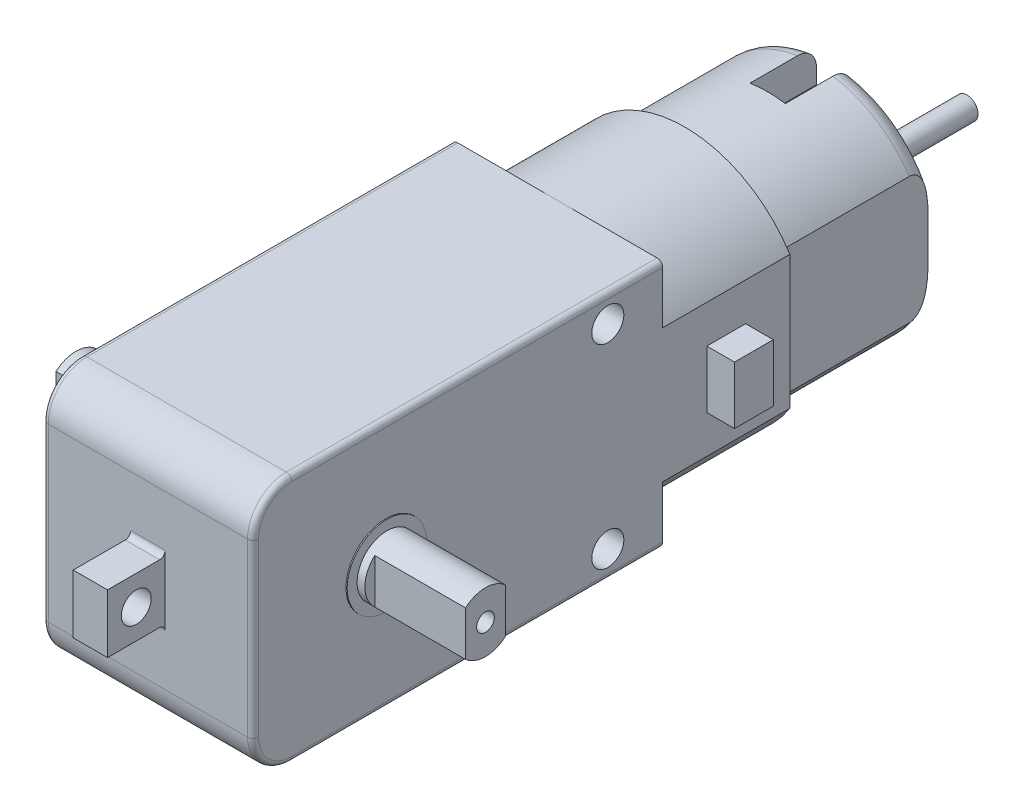
from build123d import *

# Parameters (mm, degrees)
SKETCH1_W                 = 37
SKETCH1_H                 = 22.5
BOSS_EXTRUDE1_DEPTH       = 19
SKETCH2_W                 = 3.1
SKETCH2_H                 = 5.3
BOSS_EXTRUDE2_DEPTH       = 5.2
SKETCH3_R                 = 1.35
CUT_EXTRUDE1_DEPTH        = 46.050027747
FILLET1_R                 = 3.5
SKETCH4_R                 = 3.6
BOSS_EXTRUDE3_DEPTH       = 0.1
BOSS_EXTRUDE4_START       = 0.1
SKETCH5_R                 = 3.6
BOSS_EXTRUDE4_DEPTH       = 0.1
SKETCH6_R                 = 2.7
BOSS_EXTRUDE5_DEPTH       = 8.9
BOSS_EXTRUDE6_START       = 8.9
SKETCH7_R                 = 2.7
BOSS_EXTRUDE6_DEPTH       = 8.9
FILLET2_R                 = 0.5
CUT_EXTRUDE2_START        = -8.2
CUT_EXTRUDE2_DEPTH        = 8.2
CUT_EXTRUDE3_DEPTH        = 8.2
M2X0_4_TAPPED_HOLE1_D     = 1.6
M2X0_4_TAPPED_HOLE1_DEPTH = 5.2
M2X0_4_TAPPED_HOLE1_TIP   = 0.480688495
M2X0_4_TAPPED_HOLE2_D     = 1.6
M2X0_4_TAPPED_HOLE2_DEPTH = 5.2
M2X0_4_TAPPED_HOLE2_TIP   = 0.480688495
SKETCH16_R                = 1.95
BOSS_EXTRUDE7_DEPTH       = 2
BOSS_EXTRUDE8_DEPTH       = 11.5
SKETCH18_W                = 3.5
SKETCH18_H                = 5.2
BOSS_EXTRUDE9_DEPTH       = 2.5
SKETCH19_W                = 3.5
SKETCH19_H                = 5.2
BOSS_EXTRUDE10_DEPTH      = 2.5
BOSS_EXTRUDE11_DEPTH      = 13.5
FILLET3_R                 = 1.7
BOSS_EXTRUDE12_DEPTH      = 2
SKETCH23_W                = 3.2
SKETCH23_H                = 6.5
SKETCH23_H_2              = 8.5
CUT_EXTRUDE4_DEPTH        = 6
SKETCH25_R                = 1.45
CUT_EXTRUDE5_DEPTH        = 52.878728782
FILLET4_R                 = 0.5
SKETCH26_R                = 1
BOSS_EXTRUDE13_DEPTH      = 10


with BuildPart() as part:
    # Sketch1 → Boss-Extrude1 (new body)
    with BuildSketch(Plane(origin=(0, 0, 0), x_dir=(0, 0, -1), z_dir=(1, 0, 0))):
        with Locations((-18.5, 0)):
            Rectangle(SKETCH1_W, SKETCH1_H)
    extrude(amount=BOSS_EXTRUDE1_DEPTH)

    # Sketch2 → Boss-Extrude2 (add)
    with BuildSketch(Plane.XY.offset(37)):
        with Locations((9.5, 0)):
            Rectangle(SKETCH2_W, SKETCH2_H)
    extrude(amount=BOSS_EXTRUDE2_DEPTH)

    # Sketch3 → Cut-Extrude1 (cut, through all)
    with BuildSketch(Plane(origin=(11.05, 0, 0), x_dir=(0, 0, -1), z_dir=(1, 0, 0))):
        with Locations((-39.6, 0)):
            Circle(SKETCH3_R)
    extrude(amount=-CUT_EXTRUDE1_DEPTH, mode=Mode.SUBTRACT)

    # Fillet1
    fillet1_edges = [part.edges().sort_by_distance(p)[0] for p in [
        (9.5, -11.25, 37),
        (9.5, 11.25, 37),
    ]]
    fillet(fillet1_edges, radius=FILLET1_R)

    # Sketch4 → Boss-Extrude3 (add)
    with BuildSketch(Plane(origin=(19, 0, 0), x_dir=(0, 0, -1), z_dir=(1, 0, 0))):
        with Locations(Location((-25, 0, 0), (0, 0, 180))):
            Circle(SKETCH4_R)
    extrude(amount=BOSS_EXTRUDE3_DEPTH)

    # Sketch5 → Boss-Extrude4 (add)
    with BuildSketch(Plane.ZY.offset(BOSS_EXTRUDE4_START)):
        with Locations((25, 0)):
            Circle(SKETCH5_R)
    extrude(amount=-BOSS_EXTRUDE4_DEPTH)

    # Sketch6 → Boss-Extrude5 (add)
    with BuildSketch(Plane(origin=(19.1, 0, 0), x_dir=(0, 0, -1), z_dir=(1, 0, 0))):
        with Locations((-25, 0)):
            Circle(SKETCH6_R)
    extrude(amount=BOSS_EXTRUDE5_DEPTH)

    # Sketch7 → Boss-Extrude6 (add)
    with BuildSketch(Plane.ZY.offset(0.1).offset(BOSS_EXTRUDE6_START)):
        with Locations(Location((25, 0, 0), (0, 0, 180))):
            Circle(SKETCH7_R)
    extrude(amount=-BOSS_EXTRUDE6_DEPTH)

    # Fillet2
    fillet2_edges = [part.edges().sort_by_distance(p)[0] for p in [
        (9.5, 2.65, 37),
        (9.5, -2.65, 37),
    ]]
    fillet(fillet2_edges, radius=FILLET2_R)

    # Sketch8 → Cut-Extrude2 (cut)
    with BuildSketch(Plane(origin=(28, 0, 0), x_dir=(0, 0, -1), z_dir=(1, 0, 0)).offset(CUT_EXTRUDE2_START)):
        with BuildLine():
            Line((-26.8, -2.01246118), (-26.8, 2.01246118))
            ThreePointArc((-26.8, 2.01246118), (-27.7, 0), (-26.8, -2.01246118))
        make_face()
        with BuildLine():
            ThreePointArc((-22.3, 0), (-22.535248491, 1.102270384), (-23.2, 2.01246118))
            Line((-23.2, 2.01246118), (-23.2, -2.01246118))
            ThreePointArc((-23.2, -2.01246118), (-22.535248491, -1.102270384), (-22.3, 0))
        make_face()
    extrude(amount=CUT_EXTRUDE2_DEPTH, mode=Mode.SUBTRACT)

    # Sketch9 → Cut-Extrude3 (cut)
    with BuildSketch(Plane.ZY.offset(9)):
        with BuildLine():
            Line((23.2, -2.01246118), (23.2, 2.01246118))
            ThreePointArc((23.2, 2.01246118), (22.3, 0), (23.2, -2.01246118))
        make_face()
        with BuildLine():
            ThreePointArc((27.7, 0), (27.464751509, 1.102270384), (26.8, 2.01246118))
            Line((26.8, 2.01246118), (26.8, -2.01246118))
            ThreePointArc((26.8, -2.01246118), (27.464751509, -1.102270384), (27.7, 0))
        make_face()
    extrude(amount=-CUT_EXTRUDE3_DEPTH, mode=Mode.SUBTRACT)

    # M2x0.4 Tapped Hole1
    with Locations(Plane(origin=(28, 0, 0), x_dir=(0, 0, -1), z_dir=(1, 0, 0))):
        with Locations((-25, 0)):
            Hole(M2X0_4_TAPPED_HOLE1_D / 2, depth=M2X0_4_TAPPED_HOLE1_DEPTH)
            with Locations((0, 0, -(M2X0_4_TAPPED_HOLE1_DEPTH + M2X0_4_TAPPED_HOLE1_TIP / 2))):  # 118° drill point
                Cone(0, M2X0_4_TAPPED_HOLE1_D / 2, M2X0_4_TAPPED_HOLE1_TIP, mode=Mode.SUBTRACT)

    # M2x0.4 Tapped Hole2
    with Locations(Plane.ZY.offset(9)):
        with Locations((25, 0)):
            Hole(M2X0_4_TAPPED_HOLE2_D / 2, depth=M2X0_4_TAPPED_HOLE2_DEPTH)
            with Locations((0, 0, -(M2X0_4_TAPPED_HOLE2_DEPTH + M2X0_4_TAPPED_HOLE2_TIP / 2))):  # 118° drill point
                Cone(0, M2X0_4_TAPPED_HOLE2_D / 2, M2X0_4_TAPPED_HOLE2_TIP, mode=Mode.SUBTRACT)

    # Sketch16 → Boss-Extrude7 (add)
    with BuildSketch(Plane.ZY):
        with Locations((13.75, 0)):
            Circle(SKETCH16_R)
    extrude(amount=BOSS_EXTRUDE7_DEPTH)

    # Sketch17 → Boss-Extrude8 (add)
    with BuildSketch(Plane(origin=(0, 0, 0), x_dir=(-1, 0, 0), z_dir=(0, 0, -1))):
        with BuildLine():
            Line((-19, 6.025985397), (-19, -6.025985397))
            ThreePointArc((-19, -6.025985397), (-10.560588754, -11.199895156), (-1.3, -7.7021101))
            Line((-1.3, -7.7021101), (-1.3, 7.7021101))
            ThreePointArc((-1.3, 7.7021101), (-10.560588754, 11.199895156), (-19, 6.025985397))
        make_face()
    extrude(amount=BOSS_EXTRUDE8_DEPTH)

    # Sketch18 → Boss-Extrude9 (add)
    with BuildSketch(Plane(origin=(19, 0, 0), x_dir=(0, 0, -1), z_dir=(1, 0, 0))):
        with Locations((5.75, 0)):
            Rectangle(SKETCH18_W, SKETCH18_H)
    extrude(amount=BOSS_EXTRUDE9_DEPTH)

    # Sketch19 → Boss-Extrude10 (add)
    with BuildSketch(Plane.ZY.offset(-1.3)):
        with Locations((-5.75, 0)):
            Rectangle(SKETCH19_W, SKETCH19_H)
    extrude(amount=BOSS_EXTRUDE10_DEPTH)

    # Sketch20 → Boss-Extrude11 (add)
    with BuildSketch(Plane(origin=(0, 0, -11.5), x_dir=(-1, 0, 0), z_dir=(0, 0, -1))):
        with BuildLine():
            Line((-18, 5.728219619), (-18, -5.728219619))
            ThreePointArc((-18, -5.728219619), (-10.518083587, -10.199313987), (-2.3, -7.295375247))
            Line((-2.3, -7.295375247), (-2.3, 7.295375247))
            ThreePointArc((-2.3, 7.295375247), (-10.518083587, 10.199313987), (-18, 5.728219619))
        make_face()
    extrude(amount=BOSS_EXTRUDE11_DEPTH)

    # Fillet3
    fillet3_edges = [part.edges().sort_by_distance(p)[0] for p in [
        (10.518083587, 10.199313987, -25),
        (10.518083587, -10.199313987, -25),
    ]]
    fillet(fillet3_edges, radius=FILLET3_R)

    # Sketch21 → Boss-Extrude12 (add)
    with BuildSketch(Plane(origin=(0, 0, -25), x_dir=(-1, 0, 0), z_dir=(0, 0, -1))):
        with BuildLine():
            Line((-5.5, -3), (-5.5, 3))
            ThreePointArc((-5.5, 3), (-14.5, 0), (-5.5, -3))
        make_face()
    extrude(amount=BOSS_EXTRUDE12_DEPTH)

    # Sketch23 → Cut-Extrude4 (cut)
    with BuildSketch(Plane(origin=(0, 0, -25), x_dir=(-1, 0, 0), z_dir=(0, 0, -1))):
        with Locations((-9.5, 10.25)):
            Rectangle(SKETCH23_W, SKETCH23_H)
        with Locations((-9.5, -11.25)):
            Rectangle(SKETCH23_W, SKETCH23_H_2)
    extrude(amount=-CUT_EXTRUDE4_DEPTH, mode=Mode.SUBTRACT)

    # Sketch25 → Cut-Extrude5 (cut, through all)
    with BuildSketch(Plane(origin=(19, 0, 0), x_dir=(0, 0, -1), z_dir=(1, 0, 0))):
        with Locations((-4.95, 8.8)):
            Circle(SKETCH25_R)
        with Locations((-4.95, -8.8)):
            Circle(SKETCH25_R)
    extrude(amount=-CUT_EXTRUDE5_DEPTH, mode=Mode.SUBTRACT)

    # Fillet4
    fillet4_edges = [part.edges().sort_by_distance(p)[0] for p in [
        (0, -11.25, 16.75),
        (0, -10.224873734, 35.974873734),
        (0, 0, 37),
        (0, 10.224873734, 35.974873734),
        (19, -11.25, 16.75),
        (19, -10.224873734, 35.974873734),
        (19, 0, 37),
        (19, 10.224873734, 35.974873734),
        (0, 11.25, 16.75),
        (19, 11.25, 16.75),
    ]]
    fillet(fillet4_edges, radius=FILLET4_R)

    # Sketch26 → Boss-Extrude13 (add)
    with BuildSketch(Plane(origin=(0, 0, -27), x_dir=(-1, 0, 0), z_dir=(0, 0, -1))):
        with Locations((-9.5, 0)):
            Circle(SKETCH26_R)
    extrude(amount=BOSS_EXTRUDE13_DEPTH)


solid = part.part
